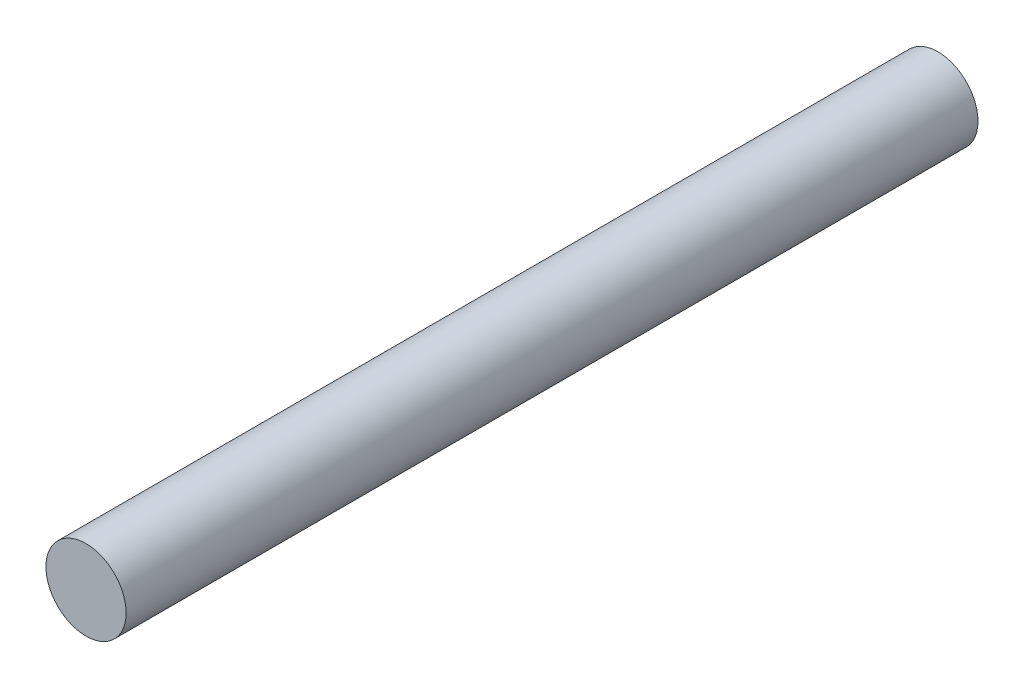
from build123d import *

# Parameters (mm, degrees)
SKETCH1_R           = 8
BOSS_EXTRUDE1_DEPTH = 170


with BuildPart() as part:
    # Sketch1 → Boss-Extrude1 (new body)
    with BuildSketch(Plane.XY):
        Circle(SKETCH1_R)
    extrude(amount=BOSS_EXTRUDE1_DEPTH)


solid = part.part
